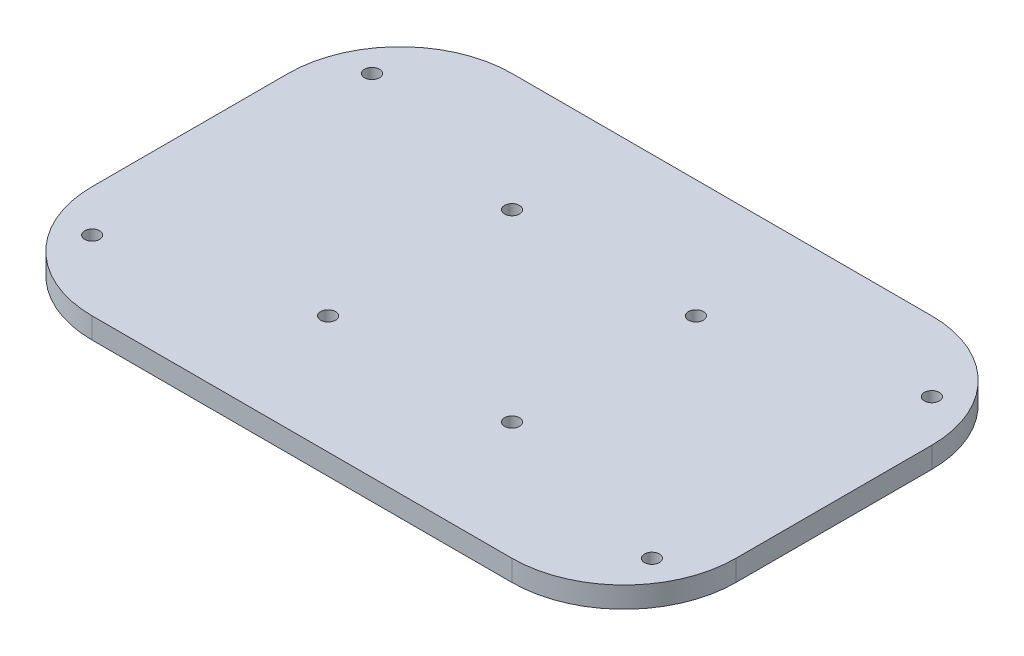
from build123d import *

# Parameters (mm, degrees)
BOSS_EXTRUDE1_DEPTH = 4.7625
SKETCH2_R           = 1.7
CUT_EXTRUDE1_DEPTH  = 88.3125
SKETCH3_R           = 1.7
CUT_EXTRUDE2_DEPTH  = 88.3125


with BuildPart() as part:
    # Sketch1 → Boss-Extrude1 (new body)
    with BuildSketch(Plane(origin=(0, 0, 0), x_dir=(1, 0, 0), z_dir=(0, 1, 0))):
        with BuildLine():
            Line((-47.625, -47.625), (47.625, -47.625))
            ThreePointArc((47.625, -47.625), (65.585512242, -40.185512242), (73.025, -22.225))
            Line((73.025, -22.225), (73.025, 22.225))
            ThreePointArc((73.025, 22.225), (65.585512242, 40.185512242), (47.625, 47.625))
            Line((47.625, 47.625), (-47.625, 47.625))
            ThreePointArc((-47.625, 47.625), (-65.585512242, 40.185512242), (-73.025, 22.225))
            Line((-73.025, 22.225), (-73.025, -22.225))
            ThreePointArc((-73.025, -22.225), (-65.585512242, -40.185512242), (-47.625, -47.625))
        make_face()
    extrude(amount=BOSS_EXTRUDE1_DEPTH)

    # Sketch2 → Cut-Extrude1 (cut, through all)
    with BuildSketch(Plane(origin=(0, 4.7625, 0), x_dir=(1, 0, 0), z_dir=(0, 1, 0))):
        with Locations(Location((-63.5, -31.75, 0), (0, 0, 270))):
            Circle(SKETCH2_R)
        with Locations(Location((-63.5, 31.75, 0), (0, 0, 270))):
            Circle(SKETCH2_R)
        with Locations(Location((63.5, 31.75, 0), (0, 0, 270))):
            Circle(SKETCH2_R)
        with Locations(Location((63.5, -31.75, 0), (0, 0, 270))):
            Circle(SKETCH2_R)
    extrude(amount=-CUT_EXTRUDE1_DEPTH, mode=Mode.SUBTRACT)

    # Sketch3 → Cut-Extrude2 (cut, through all)
    with BuildSketch(Plane(origin=(0, 4.7625, 0), x_dir=(1, 0, 0), z_dir=(0, 1, 0))):
        with Locations(Location((20.859650045, 20.859650045, 0), (0, 0, 270))):
            Circle(SKETCH3_R)
        with Locations(Location((-20.859650045, 20.859650045, 0), (0, 0, 270))):
            Circle(SKETCH3_R)
        with Locations(Location((-20.859650045, -20.859650045, 0), (0, 0, 270))):
            Circle(SKETCH3_R)
        with Locations(Location((20.859650045, -20.859650045, 0), (0, 0, 270))):
            Circle(SKETCH3_R)
    extrude(amount=-CUT_EXTRUDE2_DEPTH, mode=Mode.SUBTRACT)


solid = part.part
